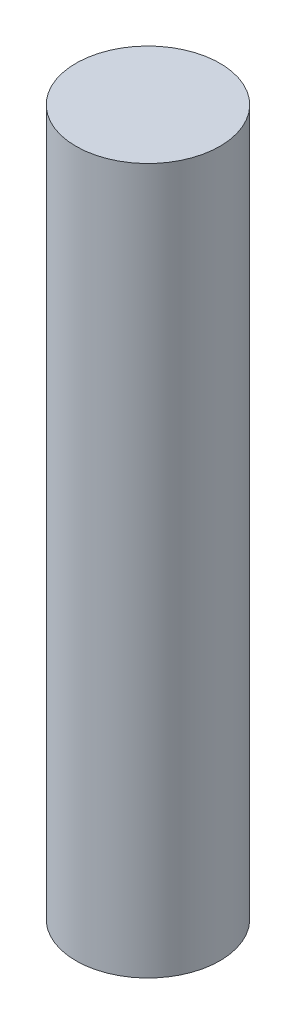
from build123d import *

# Parameters (mm, degrees)
SKETCH1_R           = 2.5
BOSS_EXTRUDE1_DEPTH = 24.5


with BuildPart() as part:
    # Sketch1 → Boss-Extrude1 (new body)
    with BuildSketch(Plane(origin=(0, 0, 0), x_dir=(1, 0, 0), z_dir=(0, 1, 0))):
        with Locations(Location((0, 0, 0), (0, 0, 270))):
            Circle(SKETCH1_R)
    extrude(amount=BOSS_EXTRUDE1_DEPTH)


solid = part.part
